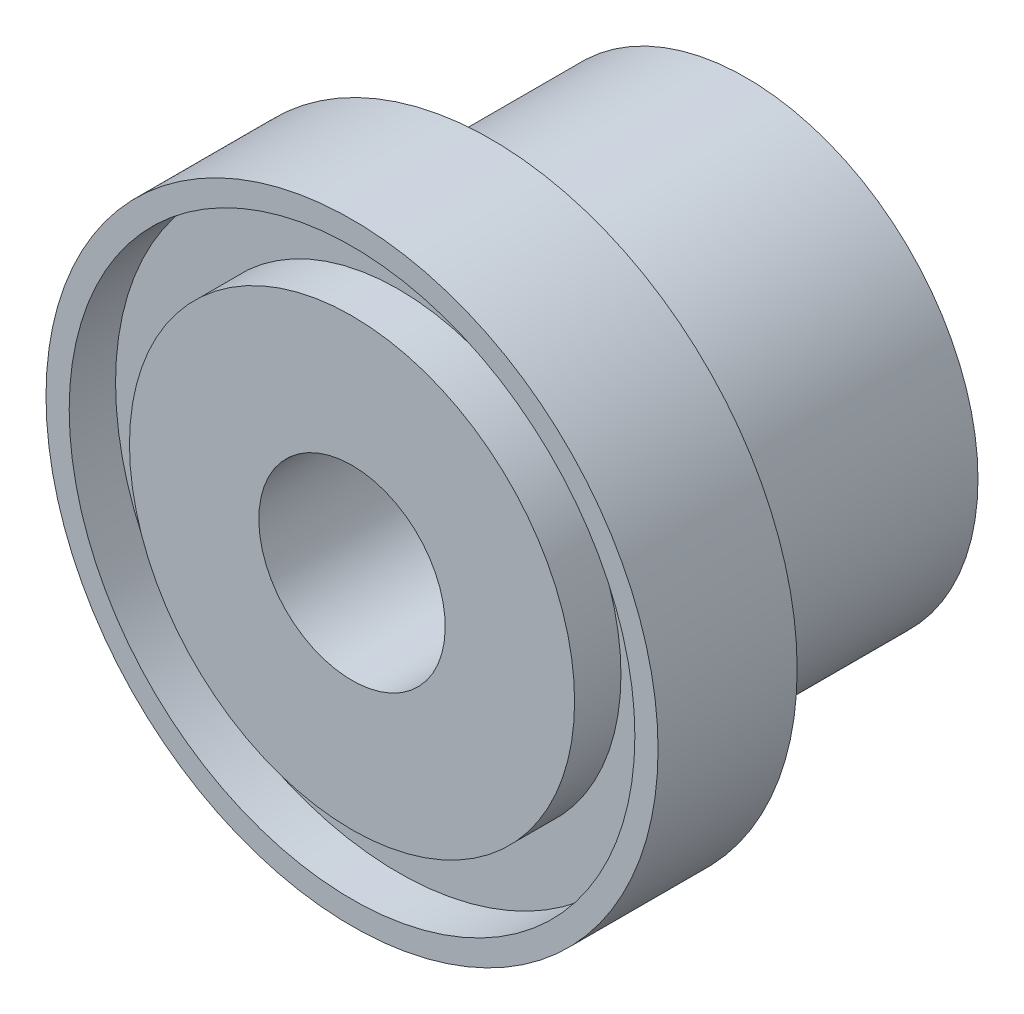
from build123d import *

# Parameters (mm, degrees)
SKETCH1_R           = 6.35
BOSS_EXTRUDE1_DEPTH = 6.985
SKETCH3_R           = 8.382
BOSS_EXTRUDE2_DEPTH = 3.81
SKETCH5_R           = 2.5527
CUT_EXTRUDE2_DEPTH  = 56.328875207
SKETCH6_R           = 7.747
SKETCH6_R_2         = 6.096
CUT_EXTRUDE3_DEPTH  = 1.27


with BuildPart() as part:
    # Sketch1 → Boss-Extrude1 (new body)
    with BuildSketch(Plane.XY):
        with Locations((43.174261814, 8.550344032)):
            Circle(SKETCH1_R)
    extrude(amount=-BOSS_EXTRUDE1_DEPTH)

    # Sketch3 → Boss-Extrude2 (add)
    with BuildSketch(Plane.XY):
        with Locations(Location((43.174261814, 8.550344032, 0), (0, 0, 180))):
            Circle(SKETCH3_R)
    extrude(amount=BOSS_EXTRUDE2_DEPTH)

    # Sketch5 → Cut-Extrude2 (cut, through all)
    with BuildSketch(Plane(origin=(0, 0, -6.985), x_dir=(-1, 0, 0), z_dir=(0, 0, -1))):
        with Locations(Location((-43.174261814, 8.550344032, 0), (0, 0, 90))):
            Circle(SKETCH5_R)
    extrude(amount=-CUT_EXTRUDE2_DEPTH, mode=Mode.SUBTRACT)

    # Sketch6 → Cut-Extrude3 (cut)
    with BuildSketch(Plane.XY.offset(3.81)):
        with Locations((43.174261814, 8.550344032)):
            Circle(SKETCH6_R)
        with Locations((43.174261814, 8.550344032)):
            Circle(SKETCH6_R_2, mode=Mode.SUBTRACT)
    extrude(amount=-CUT_EXTRUDE3_DEPTH, mode=Mode.SUBTRACT)


solid = part.part
